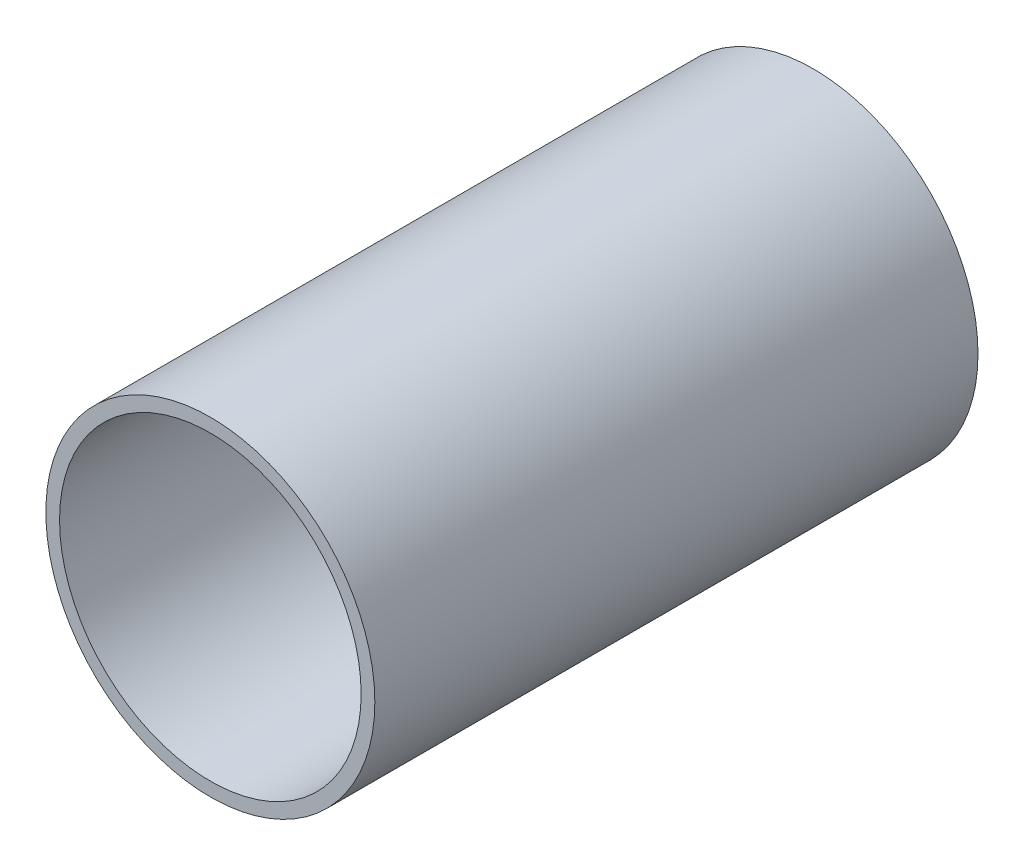
from build123d import *

# Parameters (mm, degrees)
SKETCH1_R           = 38.1
SKETCH1_R_2         = 34.925
BOSS_EXTRUDE1_DEPTH = 139.7


with BuildPart() as part:
    # Sketch1 → Boss-Extrude1 (new body)
    with BuildSketch(Plane.XY):
        Circle(SKETCH1_R)
        Circle(SKETCH1_R_2, mode=Mode.SUBTRACT)
    extrude(amount=BOSS_EXTRUDE1_DEPTH)


solid = part.part
